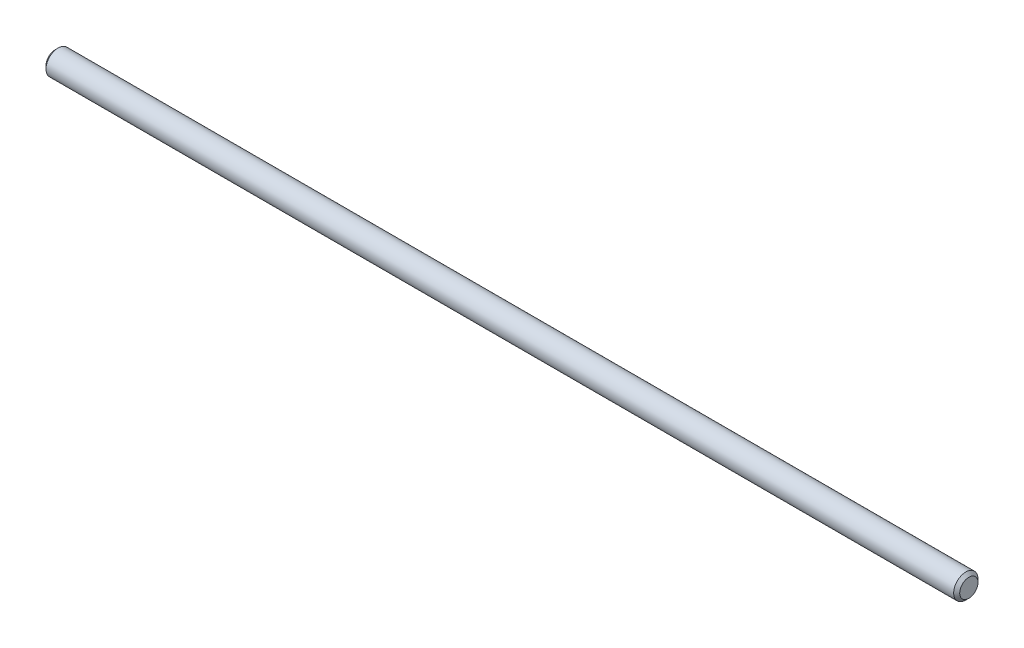
from build123d import *

# Parameters (mm, degrees)
CROQUIS1_R              = 4
SALIENTE_EXTRUIR1_DEPTH = 300
CHAFL_N1_SIZE           = 1
CHAFL_N2_SIZE           = 1


with BuildPart() as part:
    # Croquis1 → Saliente-Extruir1 (new body)
    with BuildSketch(Plane(origin=(0, 0, 0), x_dir=(0, 0, -1), z_dir=(1, 0, 0))):
        Circle(CROQUIS1_R)
    extrude(amount=SALIENTE_EXTRUIR1_DEPTH)

    # Chaflán1
    chafl_n1_edges = [part.edges().sort_by_distance(p)[0] for p in [
        (300, 0, 4),
    ]]
    chamfer(chafl_n1_edges, length=CHAFL_N1_SIZE)

    # Chaflán2
    chafl_n2_edges = [part.edges().sort_by_distance(p)[0] for p in [
        (0, 0, 4),
    ]]
    chamfer(chafl_n2_edges, length=CHAFL_N2_SIZE)


solid = part.part
